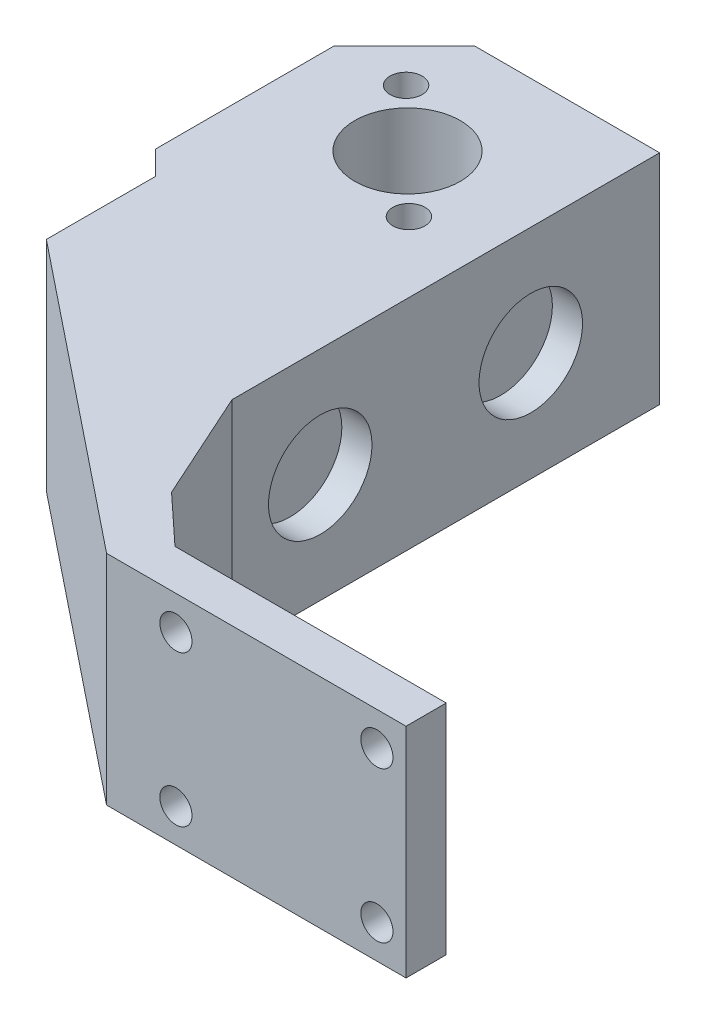
from build123d import *

# Parameters (mm, degrees)
SKICA1_W                 = 25.8
SKICA1_H                 = 21.7
SKICA1_R                 = 1.6
P_IDAT_VYSUNUT_M1_DEPTH  = 4
SKICA2_W                 = 4
SKICA2_H                 = 21.7
P_IDAT_VYSUNUT_M2_DEPTH  = 4
SKICA4_R                 = 5.25
SKICA4_R_2               = 1.6
P_IDAT_VYSUNUT_M3_DEPTH  = 21.7
ZKOSEN_1_SIZE            = 7
SKICA5_R                 = 5.15
ODEBRAT_VYSUNUT_M1_DEPTH = 3


with BuildPart() as part:
    # Skica1 → Přidat vysunutím1 (new body)
    with BuildSketch(Plane.XY):
        with Locations((3.311981452, -9.09140889)):
            Rectangle(SKICA1_W, SKICA1_H)
        with Locations((-6.688018548, -1.59140889)):
            Circle(SKICA1_R, mode=Mode.SUBTRACT)
        with Locations((13.311981452, -1.59140889)):
            Circle(SKICA1_R, mode=Mode.SUBTRACT)
        with Locations((13.311981452, -16.59140889)):
            Circle(SKICA1_R, mode=Mode.SUBTRACT)
        with Locations((-6.688018548, -16.59140889)):
            Circle(SKICA1_R, mode=Mode.SUBTRACT)
    extrude(amount=P_IDAT_VYSUNUT_M1_DEPTH)

    # Skica2 → Přidat vysunutím2 (add)
    with BuildSketch(Plane.ZY.offset(9.588018548)):
        with Locations((2, -9.09140889)):
            Rectangle(SKICA2_W, SKICA2_H)
    extrude(amount=P_IDAT_VYSUNUT_M2_DEPTH)

    # Skica4 → Přidat vysunutím3 (add)
    with BuildSketch(Plane(origin=(0, 1.75859111, 0), x_dir=(1, 0, 0), z_dir=(0, 1, 0))):
        Polygon((-13.588018548, -4), (-13.588018548, 0), (-10.783404097, 0), (-15.62281297, 4.500209586), (-20.589130875, 15.483860416), (-20.589130875, 33.262325999), (-20.589130875, 58.037674001), (-45.99437508, 58.037674001), (-45.99437508, 33.262325999), (-43.640152305, 30.908103223), (-43.640152305, 20.059780683), align=None)
        with Locations(Location((-33.291752977, 45.65, 0), (0, 0, 270))):
            Circle(SKICA4_R, mode=Mode.SUBTRACT)
        with Locations(Location((-39.019164168, 51.235406078, 0), (0, 0, 270))):
            Circle(SKICA4_R_2, mode=Mode.SUBTRACT)
        with Locations(Location((-27.564341787, 40.064593922, 0), (0, 0, 270))):
            Circle(SKICA4_R_2, mode=Mode.SUBTRACT)
    extrude(amount=-P_IDAT_VYSUNUT_M3_DEPTH)

    # Zkosení1
    zkosen_1_edges = [part.edges().sort_by_distance(p)[0] for p in [
        (-45.99437508, -9.09140889, -58.037674001),
    ]]
    chamfer(zkosen_1_edges, length=ZKOSEN_1_SIZE)

    # Skica5 → Odebrat vysunutím1 (cut)
    with BuildSketch(Plane(origin=(-20.589130875, 0, 0), x_dir=(0, 0, -1), z_dir=(1, 0, 0))):
        with Locations((24.263711451, -9.09140889)):
            Circle(SKICA5_R)
        with Locations((45.216218307, -9.09140889)):
            Circle(SKICA5_R)
    extrude(amount=-ODEBRAT_VYSUNUT_M1_DEPTH, mode=Mode.SUBTRACT)


solid = part.part
